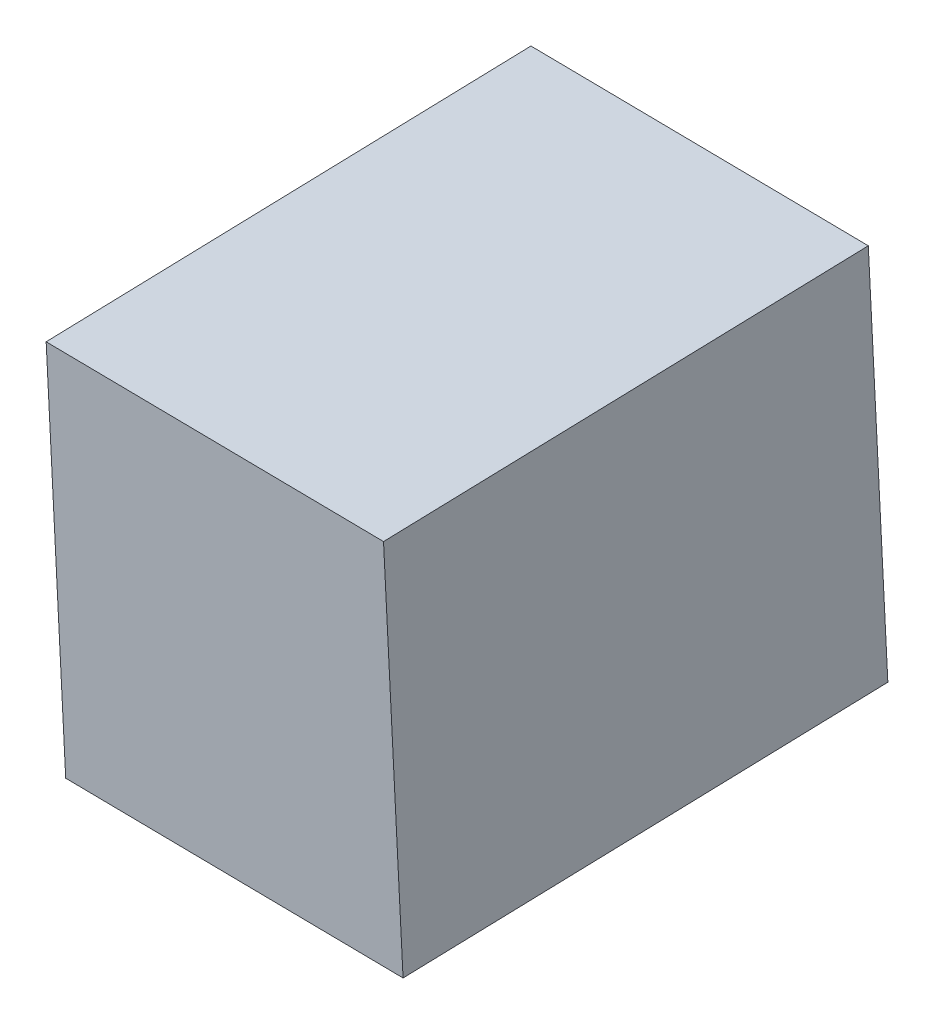
from build123d import *

# Parameters (mm, degrees)
BOSS_EXTRUDE1_DEPTH         = 40
M10X1_25_TAPPED_HOLE1_D     = 8.8
M10X1_25_TAPPED_HOLE1_DEPTH = 10
M10X1_25_TAPPED_HOLE1_TIP   = 2.643786724


with BuildPart() as part:
    # Sketch1 → Boss-Extrude1 (new body)
    with BuildSketch(Plane(origin=(-407.523949035, -1.773656994, -6.913182302), x_dir=(0.01696126662903347, 3.690723310511945e-05, -0.99985614668921), z_dir=(0.9998466777110684, 0.004351609412378134, 0.016961266629033474))):
        Polygon((-575.226758447, 44.985593464), (-573.177194833, 0.028597337), (-517.605829152, 2.562063958), (-519.655392766, 47.519060086), align=None)
    extrude(amount=BOSS_EXTRUDE1_DEPTH)

    # M10x1.25 Tapped Hole1
    with Locations(Plane(origin=(-407.523949035, -1.773656994, -6.913182302), x_dir=(-0.016961266629033415, -3.690723310511849e-05, 0.99985614668921), z_dir=(-0.9998466777110684, -0.004351609412377967, -0.016961266629033418))):
        with Locations((564.098413091, 20.463266947), (539.12435261, 21.601820011)):
            Hole(M10X1_25_TAPPED_HOLE1_D / 2, depth=M10X1_25_TAPPED_HOLE1_DEPTH)
            with Locations((0, 0, -(M10X1_25_TAPPED_HOLE1_DEPTH + M10X1_25_TAPPED_HOLE1_TIP / 2))):  # 118° drill point
                Cone(0, M10X1_25_TAPPED_HOLE1_D / 2, M10X1_25_TAPPED_HOLE1_TIP, mode=Mode.SUBTRACT)


solid = part.part
